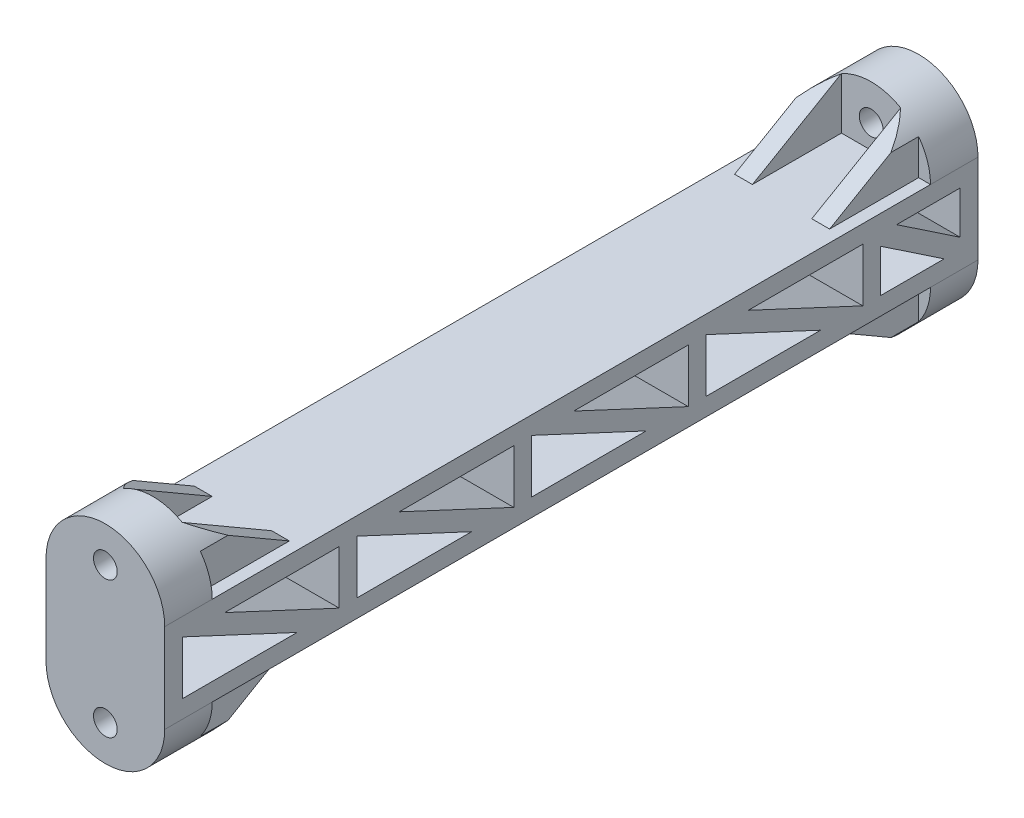
from build123d import *

# Parameters (mm, degrees)
SKETCH1_R             = 2
BOSS_EXTRUDE1_DEPTH   = 8
BOSS_EXTRUDE1_2_DEPTH = 8
BOSS_EXTRUDE2_DEPTH   = 20
BOSS_EXTRUDE3_DEPTH   = 20
BOSS_EXTRUDE4_START   = -8
SKETCH4_R             = 2
BOSS_EXTRUDE4_DEPTH   = 8
CUT_EXTRUDE1_DEPTH    = 133.91350571
SKETCH7_W             = 3
SKETCH7_H             = 9
BOSS_EXTRUDE5_DEPTH   = 20
BOSS_EXTRUDE6_DEPTH   = 3
CUT_EXTRUDE2_DEPTH    = 132.780119897
MIRROR2_COPY_1_DEPTH  = 3
MIRROR2_COPY_2_DEPTH  = 132.780119897
MIRROR3_COPY_1_DEPTH  = 3
MIRROR3_COPY_2_DEPTH  = 132.780119897
MIRROR3_COPY_3_DEPTH  = 3
MIRROR3_COPY_4_DEPTH  = 132.780119897
MIRROR3_COPY_5_DEPTH  = 3
MIRROR3_COPY_6_DEPTH  = 132.780119897


with BuildPart() as part:
    # Sketch1 → Boss-Extrude1 (new body)
    with BuildSketch(Plane.XY):
        with BuildLine():
            Line((-10, -15), (10, -15))
            ThreePointArc((10, -15), (0, -25), (-10, -15))
        make_face()
        with Locations((0, -19)):
            Circle(SKETCH1_R, mode=Mode.SUBTRACT)
    extrude(amount=-BOSS_EXTRUDE1_DEPTH)



with BuildPart() as body_2:
    # Sketch1 → Boss-Extrude1 2 (new body)
    with BuildSketch(Plane.XY):
        with BuildLine():
            Line((10, 0), (-10, 0))
            ThreePointArc((-10, 0), (0, 10), (10, 0))
        make_face()
        with Locations((0, 4)):
            Circle(SKETCH1_R, mode=Mode.SUBTRACT)
    extrude(amount=-BOSS_EXTRUDE1_2_DEPTH)


with BuildPart() as part_1:
    add(part.part)

    add(body_2.part)  # Boss-Extrude2 merges body 2
    # Sketch2 → Boss-Extrude2 (add)
    with BuildSketch(Plane.ZY.offset(10)):
        Polygon((0, -15), (67, -15), (67, -7.5), (54, -7.5), (54, 0), (0, 0), (-8, 0), (-8, -15), align=None)
    extrude(amount=-BOSS_EXTRUDE2_DEPTH)

    # Sketch3 → Boss-Extrude3 (add)
    with BuildSketch(Plane.ZY.offset(10)):
        Polygon((54, 0), (54, -7.5), (67, -7.5), (67, -15), (121, -15), (129, -15), (129, 0), (121, 0), align=None)
    extrude(amount=-BOSS_EXTRUDE3_DEPTH)

    # Sketch4 → Boss-Extrude4 (add)
    # profile 1 of 2: a face of its own
    with BuildSketch(Plane(origin=(0, 0, 121), x_dir=(-1, 0, 0), z_dir=(0, 0, -1)).offset(BOSS_EXTRUDE4_START)):
        with BuildLine():
            Line((-10, 0), (10, 0))
            ThreePointArc((10, 0), (0, 10), (-10, 0))
        make_face()
        with Locations(Location((0, 4, 0), (0, 0, 180))):
            Circle(SKETCH4_R, mode=Mode.SUBTRACT)
    # profile 2 of 2: a face of its own
    with BuildSketch(Plane(origin=(0, 0, 121), x_dir=(-1, 0, 0), z_dir=(0, 0, -1)).offset(BOSS_EXTRUDE4_START)):
        with BuildLine():
            Line((10, -15), (-10, -15))
            ThreePointArc((-10, -15), (0, -25), (10, -15))
        make_face()
        with Locations(Location((0, -19, 0), (0, 0, 180))):
            Circle(SKETCH4_R, mode=Mode.SUBTRACT)
    extrude(amount=BOSS_EXTRUDE4_DEPTH)

    # Sketch6 → Cut-Extrude1 (cut, through all)
    with BuildSketch(Plane(origin=(10, 0, 0), x_dir=(0, 0, -1), z_dir=(1, 0, 0))):
        Polygon((0, -3), (-121, -3), (-126, -3), (-126, -12), (-121, -12), (0, -12), (5, -12), (5, -3), align=None)
    extrude(amount=-CUT_EXTRUDE1_DEPTH, mode=Mode.SUBTRACT)

    # Sketch7 → Boss-Extrude5 (add)
    with BuildSketch(Plane(origin=(10, 0, 0), x_dir=(0, 0, -1), z_dir=(1, 0, 0))):
        Polygon((5, -12), (-8.403331864, -3), (-8.403331864, -4.806786238), (2.309227161, -12), align=None)
        Polygon((-5.712559024, -3), (-8.403331864, -3), (5, -12), (5, -10.193213762), align=None)
        Polygon((-11.403331864, -3), (-11.403331864, -12), (-8.403331864, -12), (-8.403331864, -4.806786238), (-8.403331864, -3), align=None)
        Polygon((-30.703894148, -3), (-37.802498898, -3), (-18.501936613, -12), (-11.403331864, -12), align=None)
        with Locations((-39.302498898, -7.5)):
            Rectangle(SKETCH7_W, SKETCH7_H)
        Polygon((-60.103061182, -3), (-67.201665932, -3), (-47.901103647, -12), (-40.802498898, -12), align=None)
        with Locations((-68.701665932, -7.5)):
            Rectangle(SKETCH7_W, SKETCH7_H)
        Polygon((-89.502228216, -3), (-96.600832966, -3), (-77.300270681, -12), (-70.201665932, -12), align=None)
        with Locations((-98.100832966, -7.5)):
            Rectangle(SKETCH7_W, SKETCH7_H)
        Polygon((-118.901395251, -3), (-126, -3), (-106.699437715, -12), (-99.600832966, -12), align=None)
    extrude(amount=-BOSS_EXTRUDE5_DEPTH)

    # Sketch9 → Boss-Extrude6 (add)
    with BuildSketch(Plane(origin=(5, 0, 0), x_dir=(0, 0, -1), z_dir=(1, 0, 0))):
        Polygon((0, -15), (0, -23.702060424), (-15, -15), align=None)
    boss_extrude6 = extrude(amount=BOSS_EXTRUDE6_DEPTH)

    # Sketch10 → Cut-Extrude2 (cut, through all)
    with BuildSketch(Plane(origin=(0, 0, 0), x_dir=(-1, 0, 0), z_dir=(0, 0, -1))):
        with BuildLine():
            Line((-8, -21), (-8, -23.702060424))
            Line((-8, -23.702060424), (-5, -23.702060424))
            Line((-5, -23.702060424), (-5, -23.660254038))
            ThreePointArc((-5, -23.660254038), (-6.634699532, -22.482029278), (-8, -21))
        make_face()
    cut_extrude2 = extrude(amount=-CUT_EXTRUDE2_DEPTH, mode=Mode.SUBTRACT)

    # Mirror1: Boss-Extrude6, Cut-Extrude2 across plane
    add(boss_extrude6.mirror(Plane(origin=(0, 0, 0), x_dir=(0, 0, 1), z_dir=(1, 0, 0))))
    add(cut_extrude2.mirror(Plane(origin=(0, 0, 0), x_dir=(0, 0, 1), z_dir=(1, 0, 0))), mode=Mode.SUBTRACT)

    # Mirror2: Boss-Extrude6, Cut-Extrude2 across plane
    add(boss_extrude6.mirror(Plane(origin=(0, 0, 60.5), x_dir=(1, 0, 0), z_dir=(0, 0, -1))))
    add(cut_extrude2.mirror(Plane(origin=(0, 0, 60.5), x_dir=(1, 0, 0), z_dir=(0, 0, -1))), mode=Mode.SUBTRACT)

    # Mirror2 copy 1 sketch → Mirror2 copy 1 (add)
    with BuildSketch(Plane(origin=(-5, 0, 121), x_dir=(0, 0, 1), z_dir=(-1, 0, 0))):
        Polygon((0, -15), (0, -23.702060424), (-15, -15), align=None)
    extrude(amount=MIRROR2_COPY_1_DEPTH)

    # Mirror2 copy 2 sketch → Mirror2 copy 2 (cut, through all)
    with BuildSketch(Plane.XY.offset(121)):
        with BuildLine():
            Line((-8, -21), (-8, -23.702060424))
            Line((-8, -23.702060424), (-5, -23.702060424))
            Line((-5, -23.702060424), (-5, -23.660254038))
            ThreePointArc((-5, -23.660254038), (-6.634699532, -22.482029278), (-8, -21))
        make_face()
    extrude(amount=-MIRROR2_COPY_2_DEPTH, mode=Mode.SUBTRACT)

    # Mirror3: Boss-Extrude6, Cut-Extrude2 across plane
    add(boss_extrude6.mirror(Plane.ZX.offset(-7.5)))
    add(cut_extrude2.mirror(Plane.ZX.offset(-7.5)), mode=Mode.SUBTRACT)

    # Mirror3 copy 1 sketch → Mirror3 copy 1 (add)
    with BuildSketch(Plane(origin=(-5, -15, 0), x_dir=(0, 0, -1), z_dir=(-1, 0, 0))):
        Polygon((0, -15), (0, -23.702060424), (-15, -15), align=None)
    extrude(amount=MIRROR3_COPY_1_DEPTH)

    # Mirror3 copy 2 sketch → Mirror3 copy 2 (cut, through all)
    with BuildSketch(Plane(origin=(0, -15, 0), x_dir=(1, 0, 0), z_dir=(0, 0, -1))):
        with BuildLine():
            Line((-8, -21), (-8, -23.702060424))
            Line((-8, -23.702060424), (-5, -23.702060424))
            Line((-5, -23.702060424), (-5, -23.660254038))
            ThreePointArc((-5, -23.660254038), (-6.634699532, -22.482029278), (-8, -21))
        make_face()
    extrude(amount=-MIRROR3_COPY_2_DEPTH, mode=Mode.SUBTRACT)

    # Mirror3 copy 3 sketch → Mirror3 copy 3 (add)
    with BuildSketch(Plane(origin=(5, -15, 121), x_dir=(0, 0, 1), z_dir=(1, 0, 0))):
        Polygon((0, -15), (0, -23.702060424), (-15, -15), align=None)
    extrude(amount=MIRROR3_COPY_3_DEPTH)

    # Mirror3 copy 4 sketch → Mirror3 copy 4 (cut, through all)
    with BuildSketch(Plane(origin=(0, -15, 121), x_dir=(-1, 0, 0), z_dir=(0, 0, 1))):
        with BuildLine():
            Line((-8, -21), (-8, -23.702060424))
            Line((-8, -23.702060424), (-5, -23.702060424))
            Line((-5, -23.702060424), (-5, -23.660254038))
            ThreePointArc((-5, -23.660254038), (-6.634699532, -22.482029278), (-8, -21))
        make_face()
    extrude(amount=-MIRROR3_COPY_4_DEPTH, mode=Mode.SUBTRACT)

    # Mirror3 copy 5 sketch → Mirror3 copy 5 (add)
    with BuildSketch(Plane(origin=(-5, -15, 121), x_dir=(0, 0, 1), z_dir=(-1, 0, 0))):
        Polygon((0, 15), (0, 23.702060424), (-15, 15), align=None)
    extrude(amount=MIRROR3_COPY_5_DEPTH)

    # Mirror3 copy 6 sketch → Mirror3 copy 6 (cut, through all)
    with BuildSketch(Plane(origin=(0, -15, 121), x_dir=(1, 0, 0), z_dir=(0, 0, 1))):
        with BuildLine():
            Line((-8, 21), (-8, 23.702060424))
            Line((-8, 23.702060424), (-5, 23.702060424))
            Line((-5, 23.702060424), (-5, 23.660254038))
            ThreePointArc((-5, 23.660254038), (-6.634699532, 22.482029278), (-8, 21))
        make_face()
    extrude(amount=-MIRROR3_COPY_6_DEPTH, mode=Mode.SUBTRACT)


solid = part_1.part
